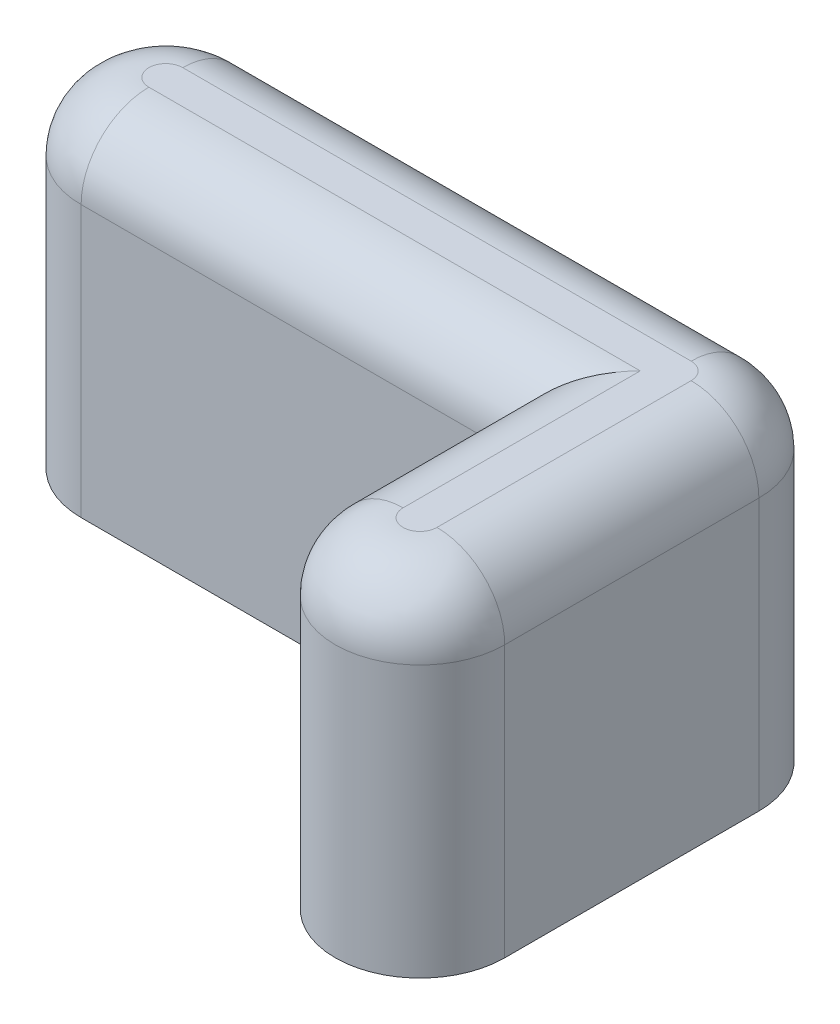
from build123d import *

# Parameters (mm, degrees)
BOSS_EXTRUDE1_DEPTH = 20
FILLET1_R           = 4
SKETCH2_R           = 2.75
CUT_EXTRUDE1_DEPTH  = 1.5
LPATTERN1_COUNT     = 2
LPATTERN1_PITCH     = 30


with BuildPart() as part:
    # Sketch1 → Boss-Extrude1 (new body)
    with BuildSketch(Plane(origin=(0, 0, 0), x_dir=(1, 0, 0), z_dir=(0, 1, 0))):
        with BuildLine():
            Line((-15, -5), (10, -5))
            Line((10, -5), (10, -15))
            ThreePointArc((10, -15), (15, -20), (20, -15))
            Line((20, -15), (20, 0))
            ThreePointArc((20, 0), (18.535533906, 3.535533906), (15, 5))
            Line((15, 5), (-15, 5))
            ThreePointArc((-15, 5), (-20, 0), (-15, -5))
        make_face()
    extrude(amount=BOSS_EXTRUDE1_DEPTH)

    # Fillet1
    fillet1_edges = [part.edges().sort_by_distance(p)[0] for p in [
        (15, 20, 20),
        (20, 20, 7.5),
        (18.535533906, 20, -3.535533906),
        (0, 20, -5),
        (-20, 20, 0),
        (-2.5, 20, 5),
        (10, 20, 10),
    ]]
    fillet(fillet1_edges, radius=FILLET1_R)

    # Sketch2 → Cut-Extrude1 (cut)
    with BuildSketch(Plane.XZ):
        with Locations(Location((-15, 0, 0), (0, 0, 270))):
            Circle(SKETCH2_R)
    cut_extrude1 = extrude(amount=-CUT_EXTRUDE1_DEPTH, mode=Mode.SUBTRACT)

    # LPattern1: Cut-Extrude1 ×2
    with Locations(*[(i * LPATTERN1_PITCH, 0, 0) for i in range(1, LPATTERN1_COUNT)]):
        add(cut_extrude1, mode=Mode.SUBTRACT)


solid = part.part
